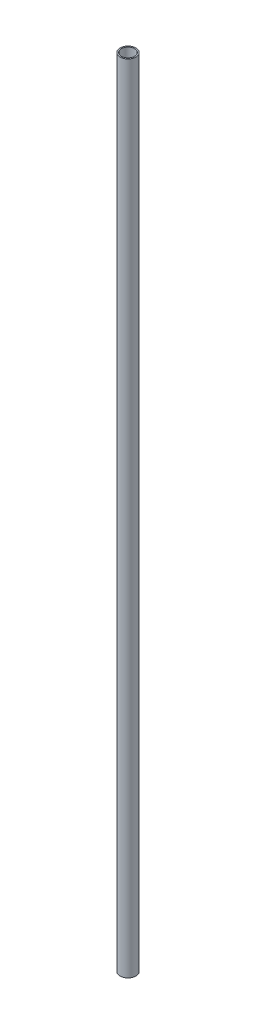
from build123d import *

# Parameters (mm, degrees)
SKETCH1_R           = 6
SKETCH1_R_2         = 5
BOSS_EXTRUDE1_DEPTH = 600


with BuildPart() as part:
    # Sketch1 → Boss-Extrude1 (new body)
    with BuildSketch(Plane(origin=(0, 0, 0), x_dir=(1, 0, 0), z_dir=(0, 1, 0))):
        with Locations(Location((0, 0, 0), (0, 0, 270))):
            Circle(SKETCH1_R)
        with Locations(Location((0, 0, 0), (0, 0, 270))):
            Circle(SKETCH1_R_2, mode=Mode.SUBTRACT)
    extrude(amount=BOSS_EXTRUDE1_DEPTH)


solid = part.part
